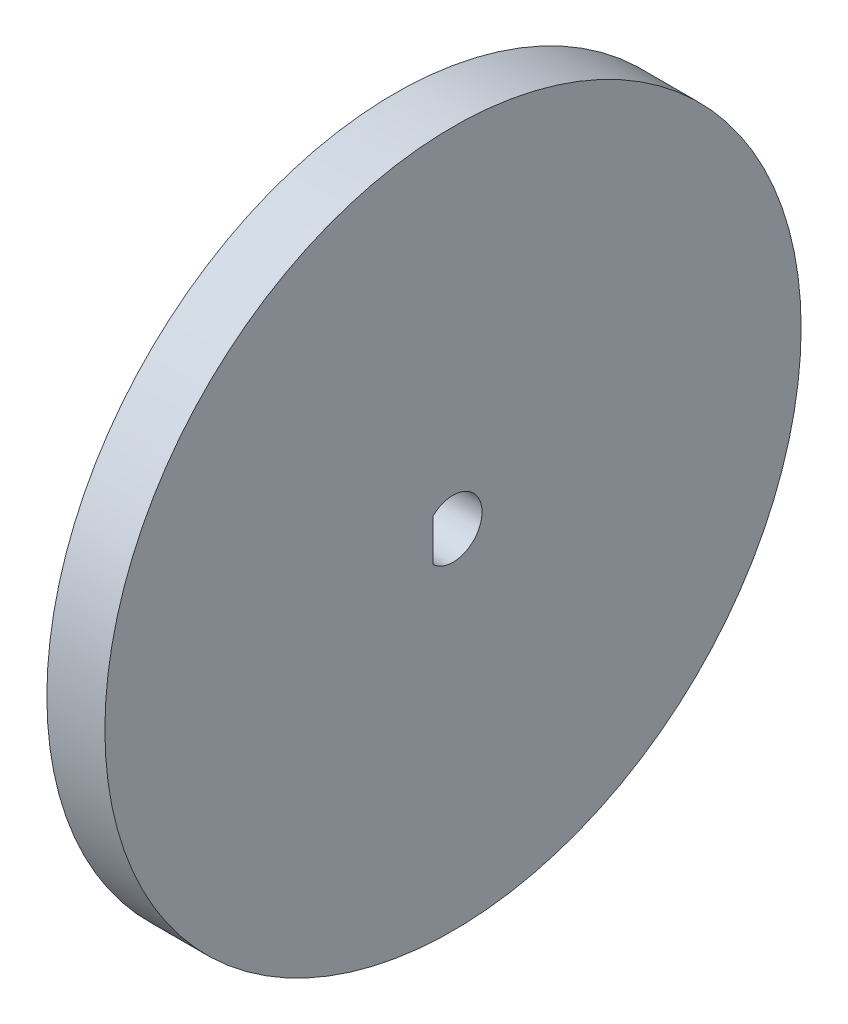
from build123d import *

# Parameters (mm, degrees)
SKETCH1_R           = 38.1
BOSS_EXTRUDE1_DEPTH = 6.35


with BuildPart() as part:
    # Sketch1 → Boss-Extrude1 (new body)
    with BuildSketch(Plane(origin=(0, 0, 0), x_dir=(0, 0, -1), z_dir=(1, 0, 0))):
        Circle(SKETCH1_R)
        with BuildLine():
            Line((-2.1844, 2.304131429), (-2.1844, -2.304131429))
            ThreePointArc((-2.1844, -2.304131429), (3.175, 0), (-2.1844, 2.304131429))
        make_face(mode=Mode.SUBTRACT)
    extrude(amount=BOSS_EXTRUDE1_DEPTH)


solid = part.part
